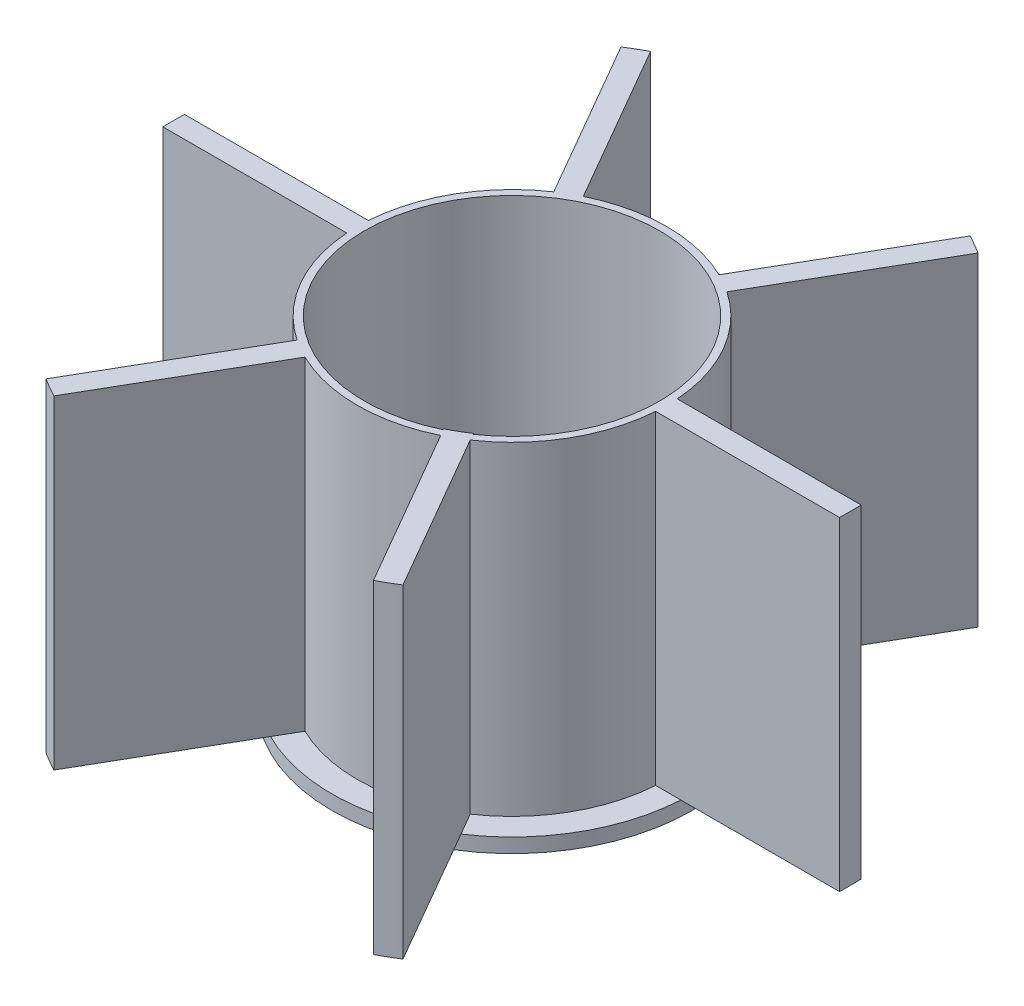
from build123d import *
from build123d.topology import SkipClean

# Parameters (mm, degrees)
SKETCH_1_R          = 25
EXTRUDE_2_DEPTH     = 2
EXTRUDE_3_DEPTH     = 45
SKETCH_3_R          = 21.5
SKETCH_3_R_2        = 20.5
EXTRUDE_4_DEPTH     = 45
SKETCH_5_R          = 21.5
EXTRUDE_5_DEPTH     = 16
CUT_EXTRUDE_1_DEPTH = 16


with BuildPart() as part:
    # 草图1 → 凸台-拉伸2 (new body)
    with BuildSketch(Plane(origin=(0, 0, 0), x_dir=(1, 0, 0), z_dir=(0, 1, 0))):
        with Locations(Location((0, 0, 0), (0, 0, 270))):
            Circle(SKETCH_1_R)
    extrude(amount=EXTRUDE_2_DEPTH)

    # 草图2 → 凸台-拉伸3 (add)
    with BuildSketch(Plane(origin=(0, 2, 0), x_dir=(1, 0, 0), z_dir=(0, 1, 0))):
        with BuildLine():
            Line((46.976057732, -1.5), (20.4450483, -1.5))
            ThreePointArc((20.4450483, -1.5), (20.5, 0), (20.4450483, 1.5))
            Line((20.4450483, 1.5), (46.976057732, 1.5))
            ThreePointArc((46.976057732, 1.5), (47, 0), (46.976057732, -1.5))
        make_face()
        with BuildLine():
            Line((8.840104317, -18.311509822), (22.189479497, -41.433305883))
            ThreePointArc((22.189479497, -41.433305883), (23.500412361, -40.704084016), (24.787406337, -39.933398601))
            Line((24.787406337, -39.933398601), (11.438034851, -16.811608937))
            ThreePointArc((11.438034851, -16.811608937), (10.166767318, -17.609533741), (8.840104317, -18.311509822))
        make_face()
        with BuildLine():
            Line((-8.923486044, -18.45593121), (-22.18899076, -41.432459365))
            ThreePointArc((-22.18899076, -41.432459365), (-23.5, -40.703193978), (-24.787066971, -39.932459365))
            Line((-24.787066971, -39.932459365), (-11.521562256, -16.95593121))
            ThreePointArc((-11.521562256, -16.95593121), (-10.25, -17.753520778), (-8.923486044, -18.45593121))
        make_face()
        with BuildLine():
            Line((-20.4450483, 1.5), (-46.976057732, 1.5))
            ThreePointArc((-46.976057732, 1.5), (-47, 0), (-46.976057732, -1.5))
            Line((-46.976057732, -1.5), (-20.4450483, -1.5))
            ThreePointArc((-20.4450483, -1.5), (-20.5, 0), (-20.4450483, 1.5))
        make_face()
        with BuildLine():
            Line((-11.521562256, 16.95593121), (-24.787066971, 39.932459365))
            ThreePointArc((-24.787066971, 39.932459365), (-23.5, 40.703193978), (-22.18899076, 41.432459365))
            Line((-22.18899076, 41.432459365), (-8.923486044, 18.45593121))
            ThreePointArc((-8.923486044, 18.45593121), (-10.25, 17.753520778), (-11.521562256, 16.95593121))
        make_face()
        with BuildLine():
            Line((8.923486044, 18.45593121), (22.18899076, 41.432459365))
            ThreePointArc((22.18899076, 41.432459365), (23.5, 40.703193978), (24.787066971, 39.932459365))
            Line((24.787066971, 39.932459365), (11.521562256, 16.95593121))
            ThreePointArc((11.521562256, 16.95593121), (10.25, 17.753520778), (8.923486044, 18.45593121))
        make_face()
    extrude(amount=EXTRUDE_3_DEPTH)

    # 草图3 → 凸台-拉伸4 (add)
    with SkipClean():  # the faces are left unmerged after this step: merging them gives an invalid solid
        with BuildSketch(Plane(origin=(0, 2, 0), x_dir=(1, 0, 0), z_dir=(0, 1, 0))):
            Circle(SKETCH_3_R)
            Circle(SKETCH_3_R_2, mode=Mode.SUBTRACT)
        extrude(amount=EXTRUDE_4_DEPTH)

    # 草图5 → 凸台-拉伸5 (add)
    with BuildSketch(Plane(origin=(0, 2, 0), x_dir=(1, 0, 0), z_dir=(0, 1, 0))):
        Circle(SKETCH_5_R)
    extrude(amount=EXTRUDE_5_DEPTH)

    # 草图6 → 切除-拉伸1 (cut)
    with BuildSketch(Plane(origin=(0, 18, 0), x_dir=(1, 0, 0), z_dir=(0, 1, 0))):
        with BuildLine():
            Line((2.1, 14.9), (2.9, 1.95))
            Line((2.9, 1.95), (8.35, 1.95))
            ThreePointArc((8.35, 1.95), (10.3, 0), (8.35, -1.95))
            Line((8.35, -1.95), (3.5, -1.95))
            Line((3.5, -1.95), (2.1, -17.9))
            ThreePointArc((2.1, -17.9), (0, -20), (-2.1, -17.9))
            Line((-2.1, -17.9), (-3.5, -1.95))
            Line((-3.5, -1.95), (-8.35, -1.95))
            ThreePointArc((-8.35, -1.95), (-10.3, 0), (-8.35, 1.95))
            Line((-8.35, 1.95), (-2.9, 1.95))
            Line((-2.9, 1.95), (-2.1, 14.9))
            ThreePointArc((-2.1, 14.9), (0, 17), (2.1, 14.9))
        make_face()
    extrude(amount=-CUT_EXTRUDE_1_DEPTH, mode=Mode.SUBTRACT)


solid = part.part
